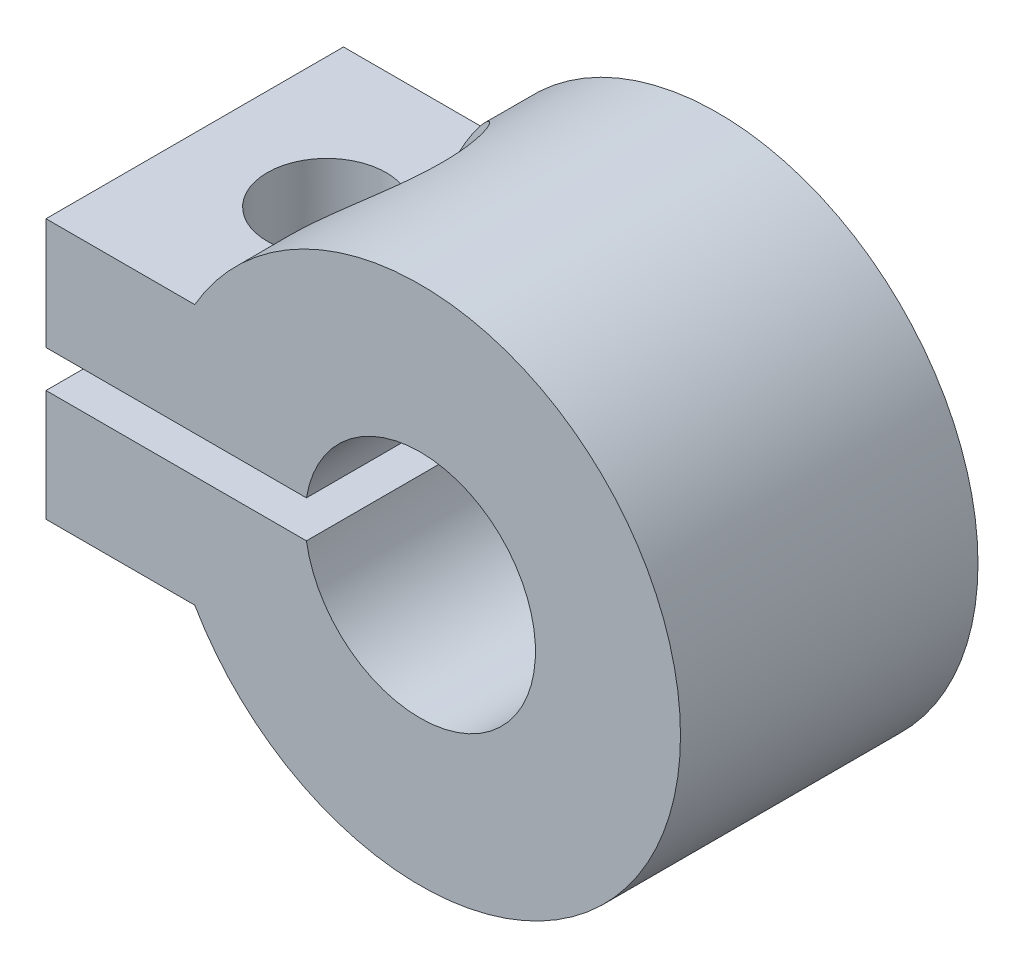
from build123d import *

# Parameters (mm, degrees)
BOSS_EXTRUDE1_DEPTH = 8
SKETCH2_R           = 1.6
CUT_EXTRUDE1_DEPTH  = 17.598115032
SKETCH3_R           = 3.1
CUT_EXTRUDE2_DEPTH  = 17.598115143
SKETCH4_R           = 3.1
CUT_EXTRUDE3_DEPTH  = 17.598115143


with BuildPart() as part:
    # Sketch1 → Boss-Extrude1 (new body)
    with BuildSketch(Plane.XY):
        with BuildLine():
            Line((-6.062177826, 3.5), (-10.062177826, 3.5))
            Line((-10.062177826, 3.5), (-10.062177826, 0.5))
            Line((-10.062177826, 0.5), (-3.059411708, 0.5))
            ThreePointArc((-3.059411708, 0.5), (3.1, 0), (-3.059411708, -0.5))
            Line((-3.059411708, -0.5), (-10.062177826, -0.5))
            Line((-10.062177826, -0.5), (-10.062177826, -3.5))
            Line((-10.062177826, -3.5), (-6.062177826, -3.5))
            ThreePointArc((-6.062177826, -3.5), (7, 0), (-6.062177826, 3.5))
        make_face()
    extrude(amount=BOSS_EXTRUDE1_DEPTH)

    # Sketch2 → Cut-Extrude1 (cut, through all)
    with BuildSketch(Plane(origin=(0, 3.5, 0), x_dir=(1, 0, 0), z_dir=(0, 1, 0))):
        with Locations(Location((-6.562177826, -3.951427487, 0), (0, 0, 90))):
            Circle(SKETCH2_R)
    extrude(amount=-CUT_EXTRUDE1_DEPTH, mode=Mode.SUBTRACT)

    # Sketch3 → Cut-Extrude2 (cut, through all)
    with BuildSketch(Plane(origin=(0, 3.5, 0), x_dir=(1, 0, 0), z_dir=(0, 1, 0))):
        with Locations((-6.562177826, -3.951427487)):
            Circle(SKETCH3_R)
    extrude(amount=CUT_EXTRUDE2_DEPTH, mode=Mode.SUBTRACT)

    # Sketch4 → Cut-Extrude3 (cut, through all)
    with BuildSketch(Plane.XZ.offset(3.5)):
        with Locations((-6.562177826, 3.951427487)):
            Circle(SKETCH4_R)
    extrude(amount=CUT_EXTRUDE3_DEPTH, mode=Mode.SUBTRACT)


solid = part.part
